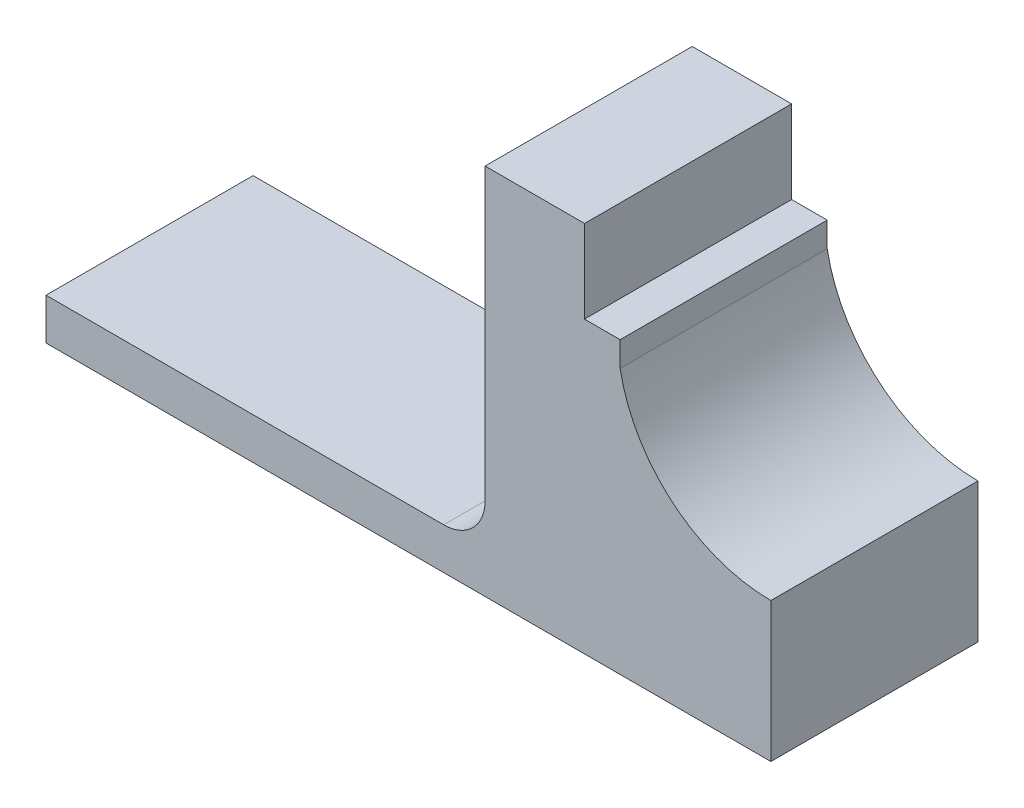
from build123d import *

# Parameters (mm, degrees)
BOSS_EXTRUDE1_DEPTH = 635


with BuildPart() as part:
    # Sketch3 → Boss-Extrude1 (new body)
    with BuildSketch(Plane.XY):
        with BuildLine():
            Line((-2079.212661728, -769.863228), (-860.012661728, -769.863228))
            ThreePointArc((-860.012661728, -769.863228), (-770.210100518, -732.665789211), (-733.012661728, -642.863228))
            Line((-733.012661728, -642.863228), (-733.012661728, 246.136772))
            Line((-733.012661728, 246.136772), (-428.150553924, 246.136772))
            Line((-428.150553924, 246.136772), (-428.150553924, -7.863228))
            Line((-428.150553924, -7.863228), (-326.612661728, -7.863228))
            Line((-326.612661728, -7.863228), (-318.929679791, -7.863228))
            Line((-318.929679791, -7.863228), (-318.929679791, -84.063228))
            ThreePointArc((-318.929679791, -84.063228), (-157.578570713, -360.389072068), (143.287338272, -469.33794683))
            Line((143.287338272, -469.33794683), (143.287338272, -896.863228))
            Line((143.287338272, -896.863228), (-2079.212661728, -896.863228))
            Line((-2079.212661728, -896.863228), (-2079.212661728, -769.863228))
        make_face()
    extrude(amount=BOSS_EXTRUDE1_DEPTH)


solid = part.part
